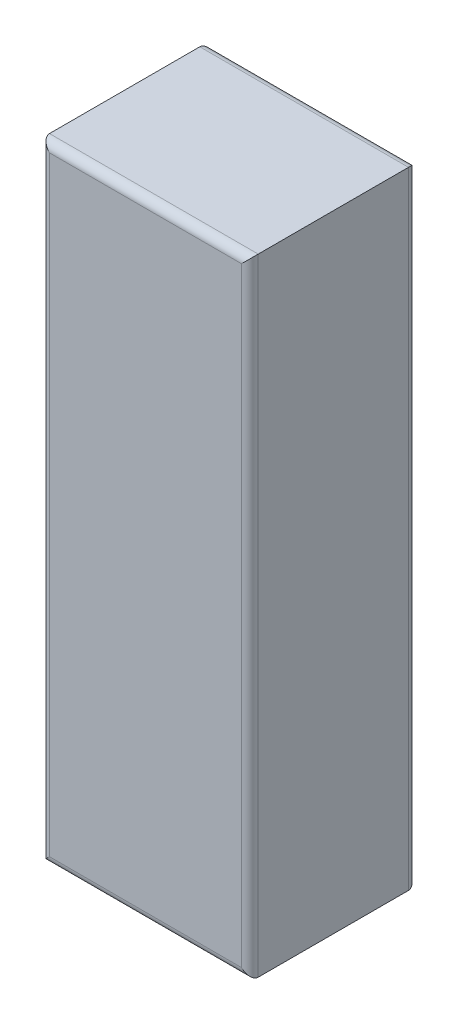
from build123d import *

# Parameters (mm, degrees)
SKETCH1_W           = 50
SKETCH1_H           = 40
BOSS_EXTRUDE1_DEPTH = 150
FILLET1_R           = 2


with BuildPart() as part:
    # Sketch1 → Boss-Extrude1 (new body)
    with BuildSketch(Plane(origin=(0, 0, 0), x_dir=(1, 0, 0), z_dir=(0, 1, 0))):
        with Locations((25, 20)):
            Rectangle(SKETCH1_W, SKETCH1_H)
    extrude(amount=BOSS_EXTRUDE1_DEPTH)

    # Fillet1
    fillet1_edges = [part.edges().sort_by_distance(p)[0] for p in [
        (25, 150, -40),
        (25, 0, -40),
        (25, 0, 0),
        (0, 75, -40),
        (50, 75, -40),
        (50, 75, 0),
        (0, 75, 0),
        (25, 150, 0),
    ]]
    fillet(fillet1_edges, radius=FILLET1_R)


solid = part.part
